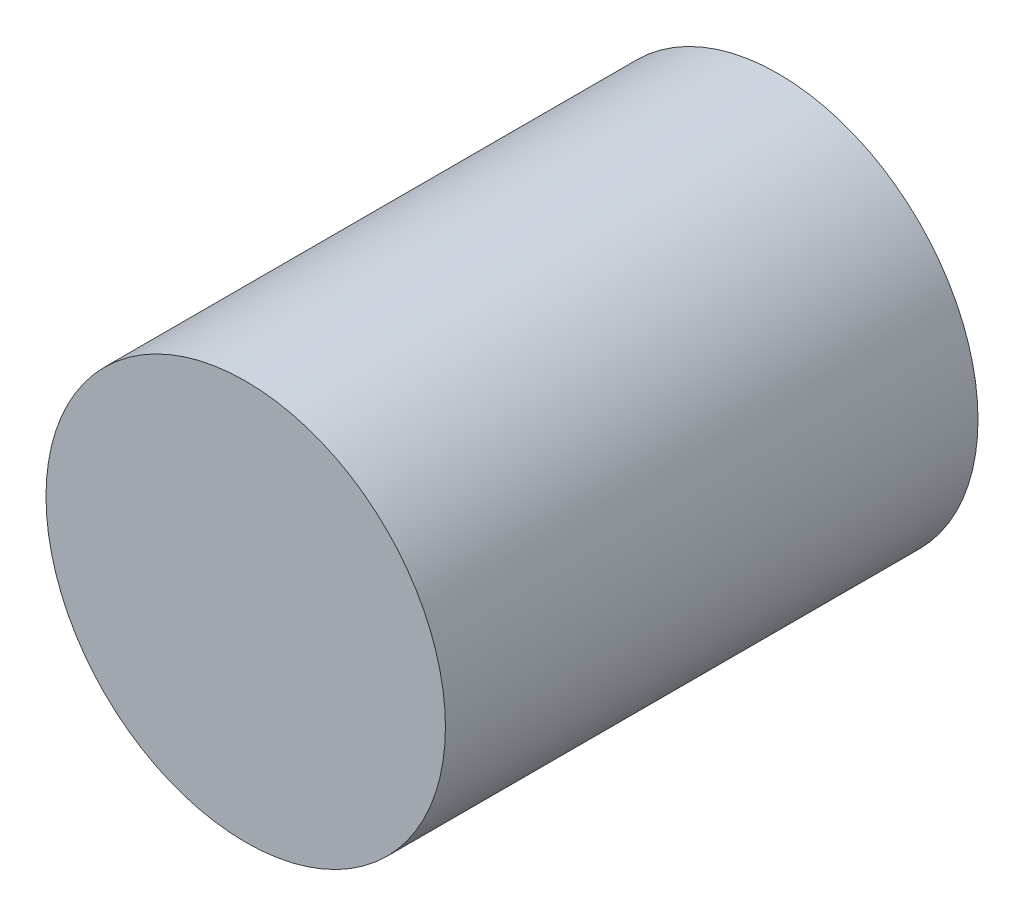
from build123d import *

# Parameters (mm, degrees)
SKETCH1_R           = 15
BOSS_EXTRUDE1_DEPTH = 40
BOSS_EXTRUDE2_START = -20
SKETCH2_R           = 15
BOSS_EXTRUDE2_DEPTH = 20


with BuildPart() as part:
    # Sketch1 → Boss-Extrude1 (new body)
    with BuildSketch(Plane.XY):
        Circle(SKETCH1_R)
        with BuildLine():
            Line((2.010289907, 10), (2.010289907, 5.970656119))
            ThreePointArc((2.010289907, 5.970656119), (5.116386733, 3.675947061), (6.3, 0))
            ThreePointArc((6.3, 0), (-3.680353244, -5.113218165), (-2, 5.974110812))
            Line((-2, 5.974110812), (-2, 10))
            Line((-2, 10), (2.010289907, 10))
        make_face(mode=Mode.SUBTRACT)
    extrude(amount=BOSS_EXTRUDE1_DEPTH)

    # Sketch2 → Boss-Extrude2 (add)
    with BuildSketch(Plane.XY.offset(40).offset(BOSS_EXTRUDE2_START)):
        Circle(SKETCH2_R)
    extrude(amount=BOSS_EXTRUDE2_DEPTH)


solid = part.part
